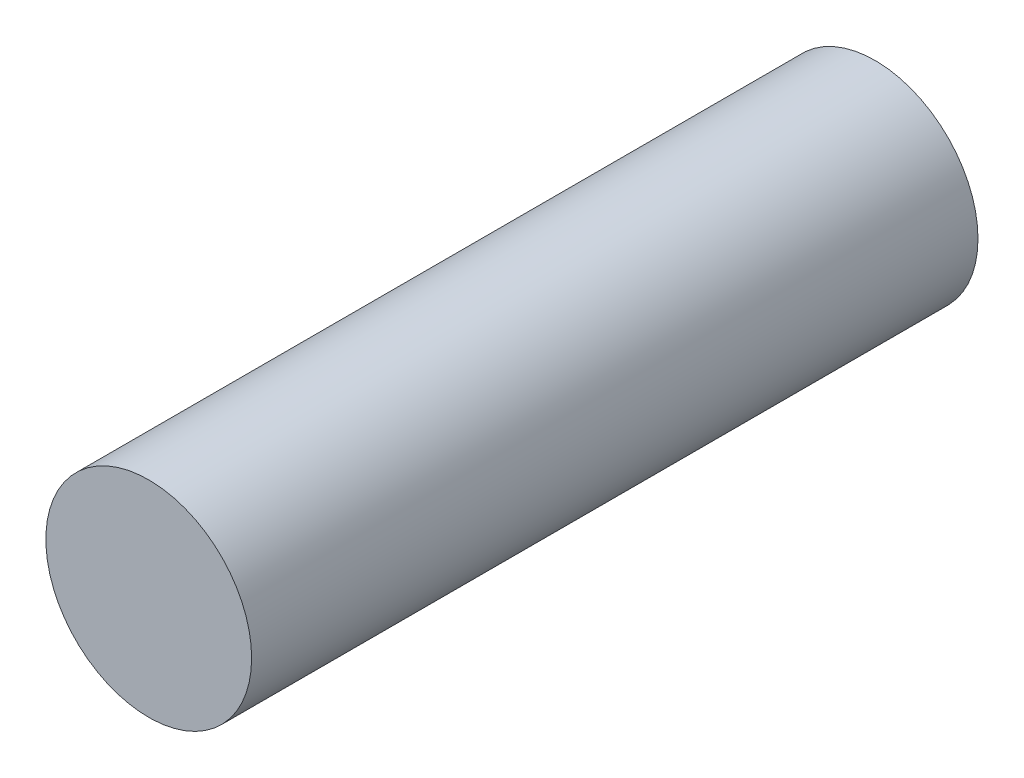
from build123d import *

# Parameters (mm, degrees)
SKETCH1_R           = 9.250000042
BOSS_EXTRUDE1_DEPTH = 32.65


with BuildPart() as part:
    # Sketch1 → Boss-Extrude1 (new, symmetric)
    with BuildSketch(Plane.XY):
        Circle(SKETCH1_R)
    extrude(amount=BOSS_EXTRUDE1_DEPTH, both=True)


solid = part.part
